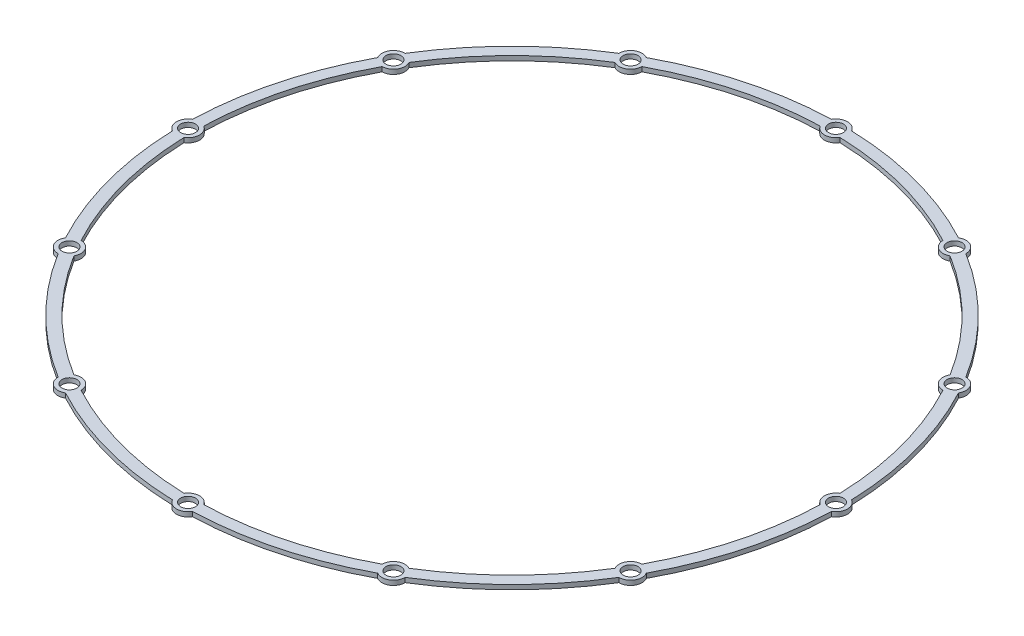
from build123d import *

# Parameters (mm, degrees)
SKETCH1_R           = 73.025
SKETCH1_R_2         = 70.485
BOSS_EXTRUDE1_DEPTH = 1.016
SKETCH1_3_R         = 2.54
SKETCH1_3_R_2       = 1.651
BOSS_EXTRUDE2_DEPTH = 1.016
SKETCH1_4_R         = 1.651
CUT_EXTRUDE1_DEPTH  = 1.016
CIRPATTERN2_COUNT   = 12


with BuildPart() as part:
    # Sketch1 → Boss-Extrude1 (new body)
    with BuildSketch(Plane(origin=(0, 0, 0), x_dir=(1, 0, 0), z_dir=(0, 1, 0))):
        with Locations(Location((0, 0, 0), (0, 0, 270))):
            Circle(SKETCH1_R)
        with Locations(Location((0, 0, 0), (0, 0, 270))):
            Circle(SKETCH1_R_2, mode=Mode.SUBTRACT)
    extrude(amount=BOSS_EXTRUDE1_DEPTH)

    # Sketch1<3> → Boss-Extrude2 (add)
    with BuildSketch(Plane(origin=(0, 0, 0), x_dir=(1, 0, 0), z_dir=(0, 1, 0))):
        with Locations((0, -71.755)):
            Circle(SKETCH1_3_R)
        with Locations((0, -71.755)):
            Circle(SKETCH1_3_R_2, mode=Mode.SUBTRACT)
    boss_extrude2 = extrude(amount=BOSS_EXTRUDE2_DEPTH)

    # Sketch1<4> → Cut-Extrude1 (cut)
    with BuildSketch(Plane(origin=(0, 0, 0), x_dir=(1, 0, 0), z_dir=(0, 1, 0))):
        with Locations(Location((0, -71.755, 0), (0, 0, 270))):
            Circle(SKETCH1_4_R)
    cut_extrude1 = extrude(amount=CUT_EXTRUDE1_DEPTH, mode=Mode.SUBTRACT)

    # CirPattern2: Boss-Extrude2, Cut-Extrude1 ×12 about axis
    cirpattern2_axis = Axis((0, 0, 0), (0, 1, 0))
    add([boss_extrude2.rotate(cirpattern2_axis, i * 360 / CIRPATTERN2_COUNT) for i in range(1, CIRPATTERN2_COUNT)])
    add([cut_extrude1.rotate(cirpattern2_axis, i * 360 / CIRPATTERN2_COUNT) for i in range(1, CIRPATTERN2_COUNT)], mode=Mode.SUBTRACT)


solid = part.part
